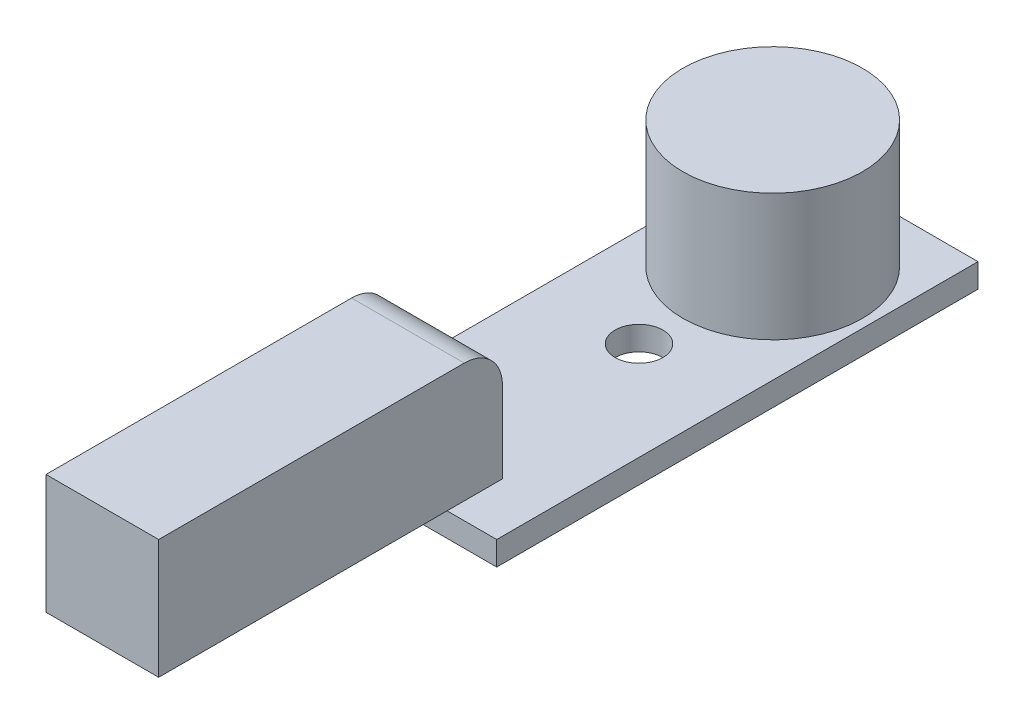
from build123d import *

# Parameters (mm, degrees)
SKETCH1_W           = 13.081
SKETCH1_H           = 32.004
SKETCH1_R           = 5.969
SKETCH1_R_2         = 1.5875
BOSS_EXTRUDE1_DEPTH = 1.5875
SKETCH2_R           = 5.969
BOSS_EXTRUDE2_DEPTH = 8.4455
SKETCH3_W           = 7.493
SKETCH3_H           = 22.86
BOSS_EXTRUDE3_DEPTH = 7.9375
FILLET1_R           = 2.54


with BuildPart() as part:
    # Sketch1 → Boss-Extrude1 (new body)
    # profile 1 of 2: a face of its own
    with BuildSketch(Plane(origin=(0, 0, 0), x_dir=(1, 0, 0), z_dir=(0, 1, 0))):
        Rectangle(SKETCH1_W, SKETCH1_H)
        with Locations((0, 8.89)):
            Circle(SKETCH1_R, mode=Mode.SUBTRACT)
        with Locations(Location((0, 0, 0), (0, 0, 270))):
            Circle(SKETCH1_R_2, mode=Mode.SUBTRACT)
    # profile 2 of 2: a face of its own
    with BuildSketch(Plane(origin=(0, 0, 0), x_dir=(1, 0, 0), z_dir=(0, 1, 0))):
        with Locations((0, 8.89)):
            Circle(SKETCH1_R)
    extrude(amount=BOSS_EXTRUDE1_DEPTH)

    # Sketch2 → Boss-Extrude2 (add)
    with BuildSketch(Plane(origin=(0, 1.5875, 0), x_dir=(1, 0, 0), z_dir=(0, 1, 0))):
        with Locations(Location((0, 8.89, 0), (0, 0, 270))):
            Circle(SKETCH2_R)
    extrude(amount=BOSS_EXTRUDE2_DEPTH)

    # Sketch3 → Boss-Extrude3 (add)
    with BuildSketch(Plane(origin=(0, 1.5875, 0), x_dir=(1, 0, 0), z_dir=(0, 1, 0))):
        with Locations((-0.508, -23.749)):
            Rectangle(SKETCH3_W, SKETCH3_H)
    extrude(amount=BOSS_EXTRUDE3_DEPTH)

    # Fillet1
    fillet1_edges = [part.edges().sort_by_distance(p)[0] for p in [
        (-0.508, 9.525, 12.319),
    ]]
    fillet(fillet1_edges, radius=FILLET1_R)


solid = part.part
